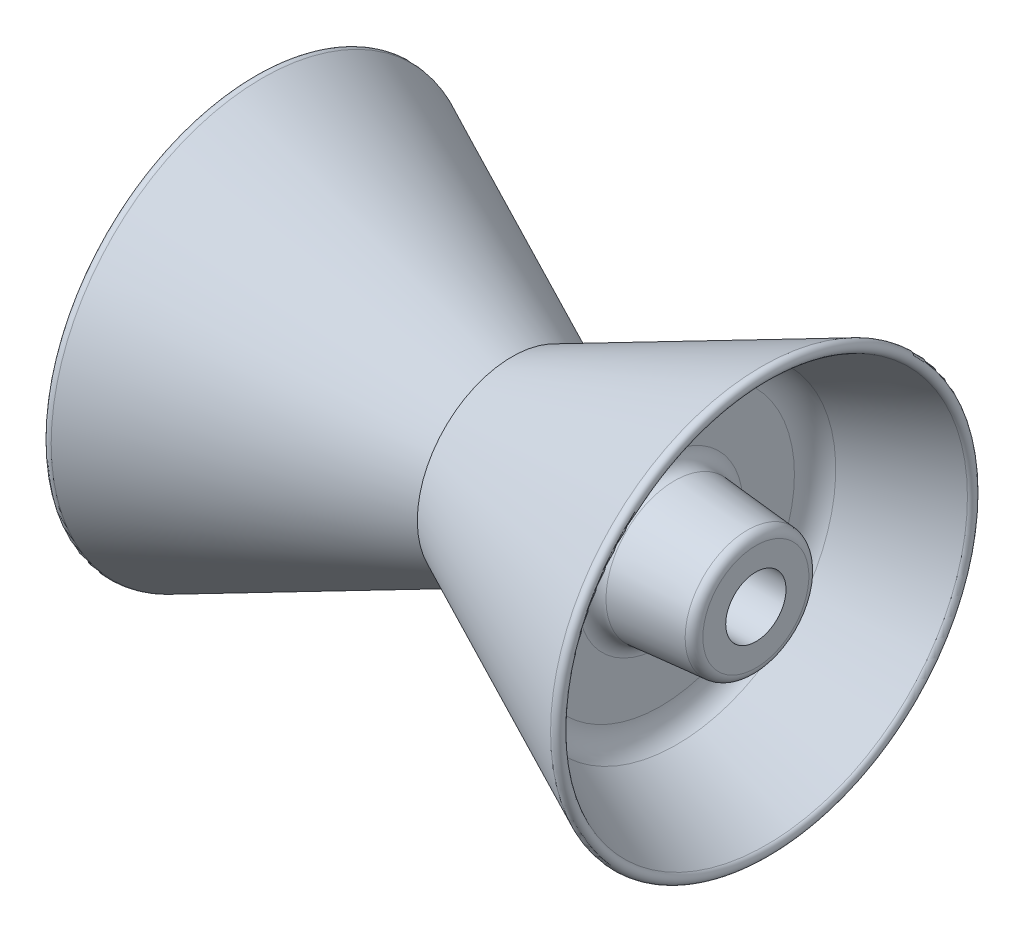
from build123d import *


with BuildPart() as part:
    # Sketch1 → Revolve1 (revolve)
    with BuildSketch(Plane.XY, mode=Mode.PRIVATE) as revolve1_sk:
        with BuildLine():
            Line((0, 0), (269.015, 125.443754659))
            ThreePointArc((269.015, 125.443754659), (276.988556293, 122.541617507), (274.086419141, 114.568061214))
            Line((274.086419141, 114.568061214), (177.321452148, 69.445816064))
            ThreePointArc((177.321452148, 69.445816064), (164.698256626, 58.375570703), (160, 42.256582453))
            Line((160, 42.256582453), (160, -13.240535028))
            ThreePointArc((160, -13.240535028), (164.393398282, -23.847136745), (175, -28.240535028))
            Line((175, -28.240535028), (253.590988889, -34.958533529))
            ThreePointArc((253.590988889, -34.958533529), (260.105326342, -38.158951382), (262.739289686, -44.922197939))
            Line((262.739289686, -44.922197939), (262.739289686, -69.516245341))
            Line((262.739289686, -69.516245341), (130, -69.516245341))
            Line((130, -69.516245341), (130, 0.288893219))
            ThreePointArc((130, 0.288893219), (116.11898825, 25.590636593), (87.321452148, 27.47812683))
            Line((87.321452148, 27.47812683), (0, -13.240535028))
            Line((0, -13.240535028), (-87.321452148, 27.47812683))
            ThreePointArc((-87.321452148, 27.47812683), (-116.11898825, 25.590636593), (-130, 0.288893219))
            Line((-130, 0.288893219), (-130, -69.516245341))
            Line((-130, -69.516245341), (-262.739289686, -69.516245341))
            Line((-262.739289686, -69.516245341), (-262.739289686, -44.922197939))
            ThreePointArc((-262.739289686, -44.922197939), (-260.105326342, -38.158951382), (-253.590988889, -34.958533529))
            Line((-253.590988889, -34.958533529), (-175, -28.240535028))
            ThreePointArc((-175, -28.240535028), (-164.393398282, -23.847136745), (-160, -13.240535028))
            Line((-160, -13.240535028), (-160, 42.256582453))
            ThreePointArc((-160, 42.256582453), (-164.698256626, 58.375570703), (-177.321452148, 69.445816064))
            Line((-177.321452148, 69.445816064), (-274.086419141, 114.568061214))
            ThreePointArc((-274.086419141, 114.568061214), (-276.988556293, 122.541617507), (-269.015, 125.443754659))
            Line((-269.015, 125.443754659), (0, 0))
        make_face()
    revolve(revolve1_sk.sketch.rotate(Axis((-336.886996408, -102.016245341, 0), (1, 0, 0)), 90), axis=Axis((-336.886996408, -102.016245341, 0), (1, 0, 0)))


solid = part.part
